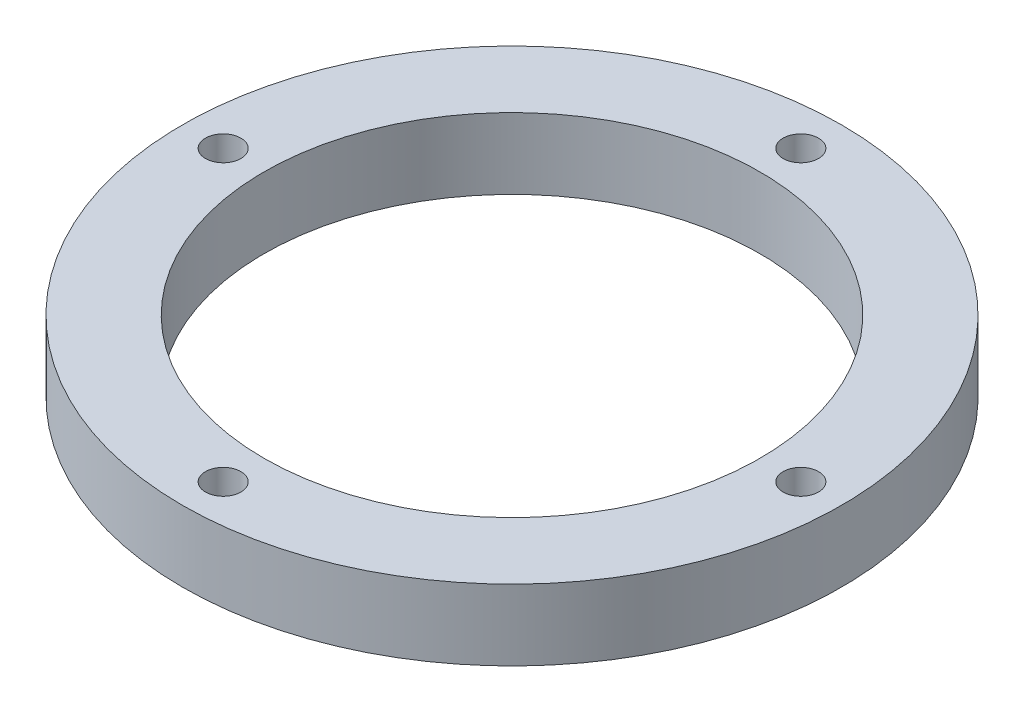
from build123d import *

# Parameters (mm, degrees)
SKETCH1_R           = 46.5
SKETCH1_R_2         = 35
SKETCH1_R_3         = 2.5
BOSS_EXTRUDE1_DEPTH = 10


with BuildPart() as part:
    # Sketch1 → Boss-Extrude1 (new body)
    with BuildSketch(Plane(origin=(0, 0, 0), x_dir=(1, 0, 0), z_dir=(0, 1, 0))):
        with Locations(Location((0, 0, 0), (0, 0, 270))):
            Circle(SKETCH1_R)
        with Locations(Location((0, 0, 0), (0, 0, 270))):
            Circle(SKETCH1_R_2, mode=Mode.SUBTRACT)
        with Locations(Location((-40.75, 0, 0), (0, 0, 270))):
            Circle(SKETCH1_R_3, mode=Mode.SUBTRACT)
        with Locations(Location((0, 40.75, 0), (0, 0, 270))):
            Circle(SKETCH1_R_3, mode=Mode.SUBTRACT)
        with Locations(Location((40.75, 0, 0), (0, 0, 270))):
            Circle(SKETCH1_R_3, mode=Mode.SUBTRACT)
        with Locations(Location((0, -40.75, 0), (0, 0, 270))):
            Circle(SKETCH1_R_3, mode=Mode.SUBTRACT)
    extrude(amount=BOSS_EXTRUDE1_DEPTH)


solid = part.part
